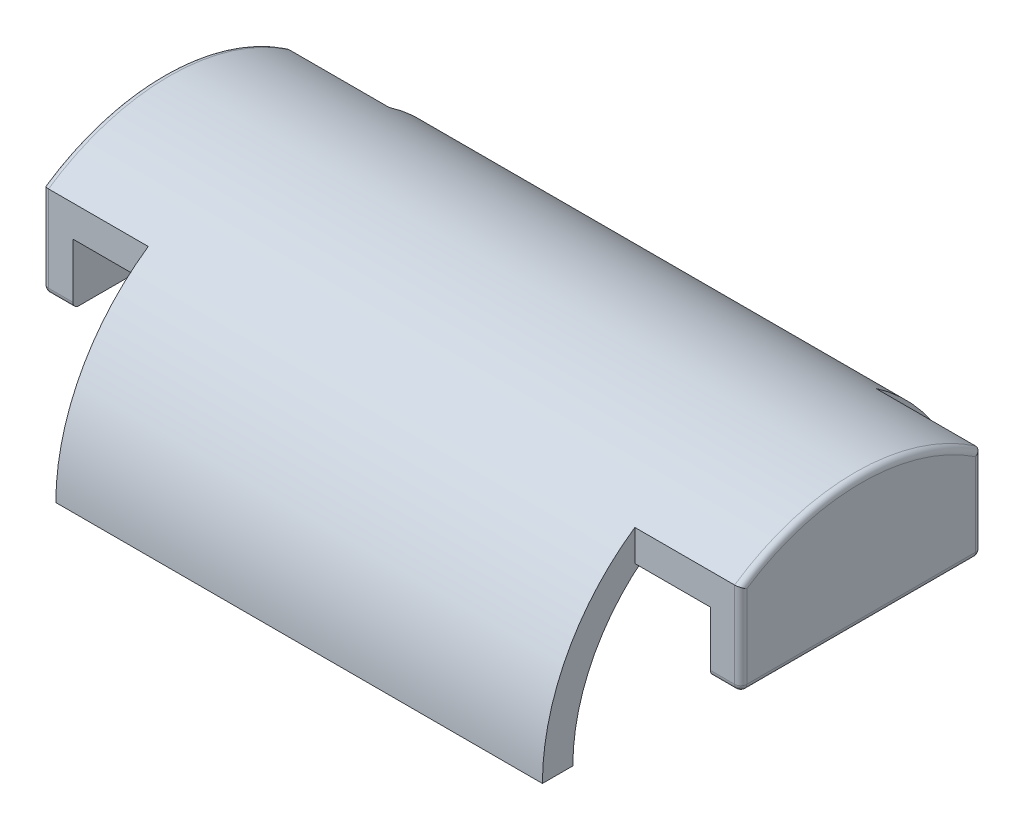
from build123d import *

# Parameters (mm, degrees)
LOWER_HALF_CUT_DEPTH   = 58.950496115
SIDE_SHELL_CUT_1_DEPTH = 6.2
SIDE_START             = -6.2
SIDE_SHELL_CUT_2_DEPTH = 6.2
BOSS_EXTRUDE3_START    = 2.5
BOSS_EXTRUDE3_DEPTH    = 2.5
BOSS_EXTRUDE4_DEPTH    = 2.5
FILLET2_R              = 0.5


with BuildPart() as part:
    # Sketch1 → Revolve1 (revolve)
    with BuildSketch(Plane.XY, mode=Mode.PRIVATE) as revolve1_sk:
        Polygon((20.2, 0), (26.2, 0), (26.2, 17.5), (-26.2, 17.5), (-26.2, 0), (-20.2, 0), (-20.2, 15), (20.2, 15), align=None)
    revolve(revolve1_sk.sketch.rotate(Axis((0, 0, 0), (-1, 0, 0)), 90), axis=Axis((0, 0, 0), (-1, 0, 0)))

    # Sketch2 → lower half cut (cut, through all)
    with BuildSketch(Plane.ZY.offset(26.2)):
        with BuildLine():
            Line((-17.5, 0), (17.5, 0))
            ThreePointArc((17.5, 0), (0, -17.5), (-17.5, 0))
        make_face()
    extrude(amount=-LOWER_HALF_CUT_DEPTH, mode=Mode.SUBTRACT)

    # Sketch3 → side shell cut 1 (cut)
    with BuildSketch(Plane.ZY.offset(26.2)):
        with BuildLine():
            Line((-17.5, 0), (17.5, 0))
            ThreePointArc((17.5, 0), (15.483862567, 8.154753215), (9.9, 14.430523206))
            Line((9.9, 14.430523206), (9.9, 11.861406616))
            Line((9.9, 11.861406616), (-9.9, 11.861406616))
            Line((-9.9, 11.861406616), (-9.9, 14.430523206))
            ThreePointArc((-9.9, 14.430523206), (-15.483862567, 8.154753215), (-17.5, 0))
        make_face()
    extrude(amount=-SIDE_SHELL_CUT_1_DEPTH, mode=Mode.SUBTRACT)

    # Sketch4 → side shell cut 2 (cut)
    with BuildSketch(Plane(origin=(26.2, 0, 0), x_dir=(0, 0, -1), z_dir=(1, 0, 0)).offset(SIDE_START)):
        with BuildLine():
            Line((-17.5, 0), (17.5, 0))
            ThreePointArc((17.5, 0), (15.483862567, 8.154753215), (9.9, 14.430523206))
            Line((9.9, 14.430523206), (9.9, 11.861406616))
            Line((9.9, 11.861406616), (-9.9, 11.861406616))
            Line((-9.9, 11.861406616), (-9.9, 14.430523206))
            ThreePointArc((-9.9, 14.430523206), (-15.483862567, 8.154753215), (-17.5, 0))
        make_face()
    extrude(amount=SIDE_SHELL_CUT_2_DEPTH, mode=Mode.SUBTRACT)

    # Sketch5 → Boss-Extrude3 (add)
    with BuildSketch(Plane.ZY.offset(26.2).offset(BOSS_EXTRUDE3_START)):
        with BuildLine():
            Line((-9.9, 14.430523206), (-9.9, 11.861406616))
            Line((-9.9, 11.861406616), (-9.9, 6.861406616))
            Line((-9.9, 6.861406616), (9.9, 6.861406616))
            Line((9.9, 6.861406616), (9.9, 11.861406616))
            Line((9.9, 11.861406616), (9.9, 14.430523206))
            ThreePointArc((9.9, 14.430523206), (0, 17.5), (-9.9, 14.430523206))
        make_face()
    extrude(amount=-BOSS_EXTRUDE3_DEPTH)

    # Sketch7 → Boss-Extrude4 (add)
    with BuildSketch(Plane(origin=(26.2, 0, 0), x_dir=(0, 0, -1), z_dir=(1, 0, 0))):
        with BuildLine():
            Line((-9.9, 6.861406616), (9.9, 6.861406616))
            Line((9.9, 6.861406616), (9.9, 14.430523206))
            ThreePointArc((9.9, 14.430523206), (0, 17.5), (-9.9, 14.430523206))
            Line((-9.9, 14.430523206), (-9.9, 6.861406616))
        make_face()
    extrude(amount=BOSS_EXTRUDE4_DEPTH)

    # Fillet2
    fillet2_edges = [part.edges().sort_by_distance(p)[0] for p in [
        (27.45, 6.861406616, -9.9),
        (27.45, 6.861406616, 9.9),
        (28.7, 10.645964911, -9.9),
        (28.7, 17.5, 0),
        (28.7, 10.645964911, 9.9),
        (28.7, 6.861406616, 0),
        (-27.45, 6.861406616, -9.9),
        (-27.45, 6.861406616, 9.9),
        (-28.7, 6.861406616, 0),
        (-28.7, 10.645964911, 9.9),
        (-28.7, 17.5, 0),
        (-28.7, 10.645964911, -9.9),
    ]]
    fillet(fillet2_edges, radius=FILLET2_R)


solid = part.part
